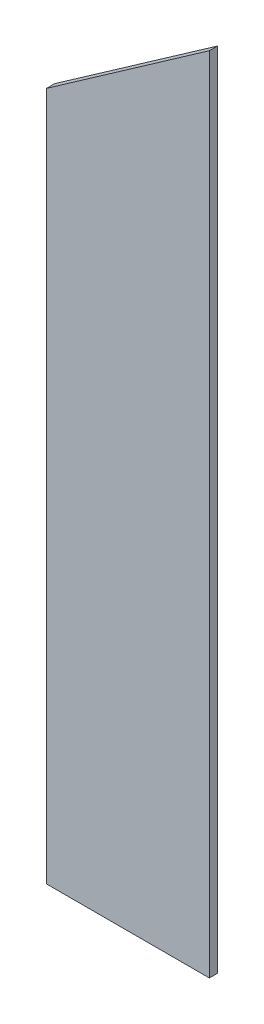
from build123d import *

# Parameters (mm, degrees)
BOSS_EXTRUDE1_DEPTH = 5


with BuildPart() as part:
    # Sketch2 → Boss-Extrude1 (new body)
    with BuildSketch(Plane.XY):
        Polygon((-50, 422.98), (-50, 0), (50, 0), (50, 422.98), (50, 493.000753821), align=None)
    extrude(amount=BOSS_EXTRUDE1_DEPTH)


solid = part.part
